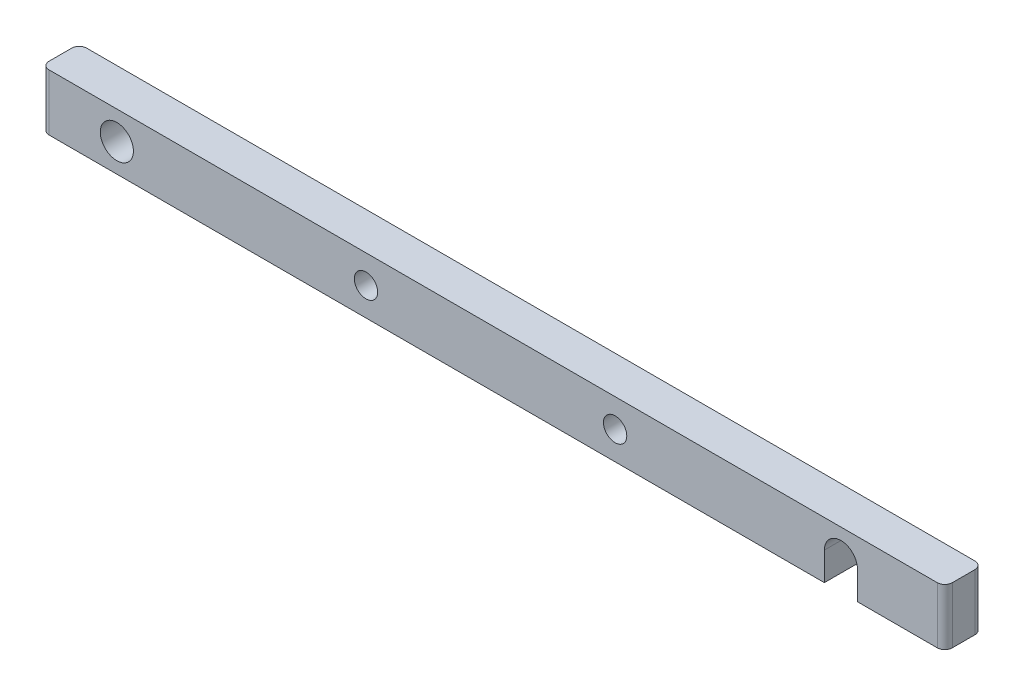
from build123d import *

# Parameters (mm, degrees)
SKETCH1_W               = 304.8
SKETCH1_H               = 19.05
BOSS_EXTRUDE1_DEPTH     = 6.35
CUT_EXTRUDE1_DEPTH      = 154.224592103
CUT_EXTRUDE1_DEPTH_BACK = 154.224592103
SKETCH2_R               = 5.588
SKETCH2_R_2             = 3.937
FILLET1_R               = 2.54


with BuildPart() as part:
    # Sketch1 → Boss-Extrude1 (new, symmetric)
    with BuildSketch(Plane.XY):
        Rectangle(SKETCH1_W, SKETCH1_H)
    extrude(amount=BOSS_EXTRUDE1_DEPTH, both=True)

    # Sketch2 → Cut-Extrude1 (cut, two sides: drawn at the far end of the back side and taken through both)
    with BuildSketch(Plane.XY.offset(6.35).offset(-CUT_EXTRUDE1_DEPTH_BACK)):
        with BuildLine():
            Line((122.936, -9.525), (122.936, 0))
            ThreePointArc((122.936, 0), (117.348, 5.588), (111.76, 0))
            Line((111.76, 0), (111.76, -9.525))
            Line((111.76, -9.525), (122.936, -9.525))
        make_face()
        with Locations((-127, 0)):
            Circle(SKETCH2_R)
        with Locations((-42.926, 0)):
            Circle(SKETCH2_R_2)
        with Locations((41.148, 0)):
            Circle(SKETCH2_R_2)
    extrude(amount=CUT_EXTRUDE1_DEPTH + CUT_EXTRUDE1_DEPTH_BACK, mode=Mode.SUBTRACT)

    # Fillet1
    fillet1_edges = [part.edges().sort_by_distance(p)[0] for p in [
        (-152.4, 0, 6.35),
        (152.4, 0, 6.35),
        (-152.4, 0, -6.35),
        (152.4, 0, -6.35),
    ]]
    fillet(fillet1_edges, radius=FILLET1_R)


solid = part.part
